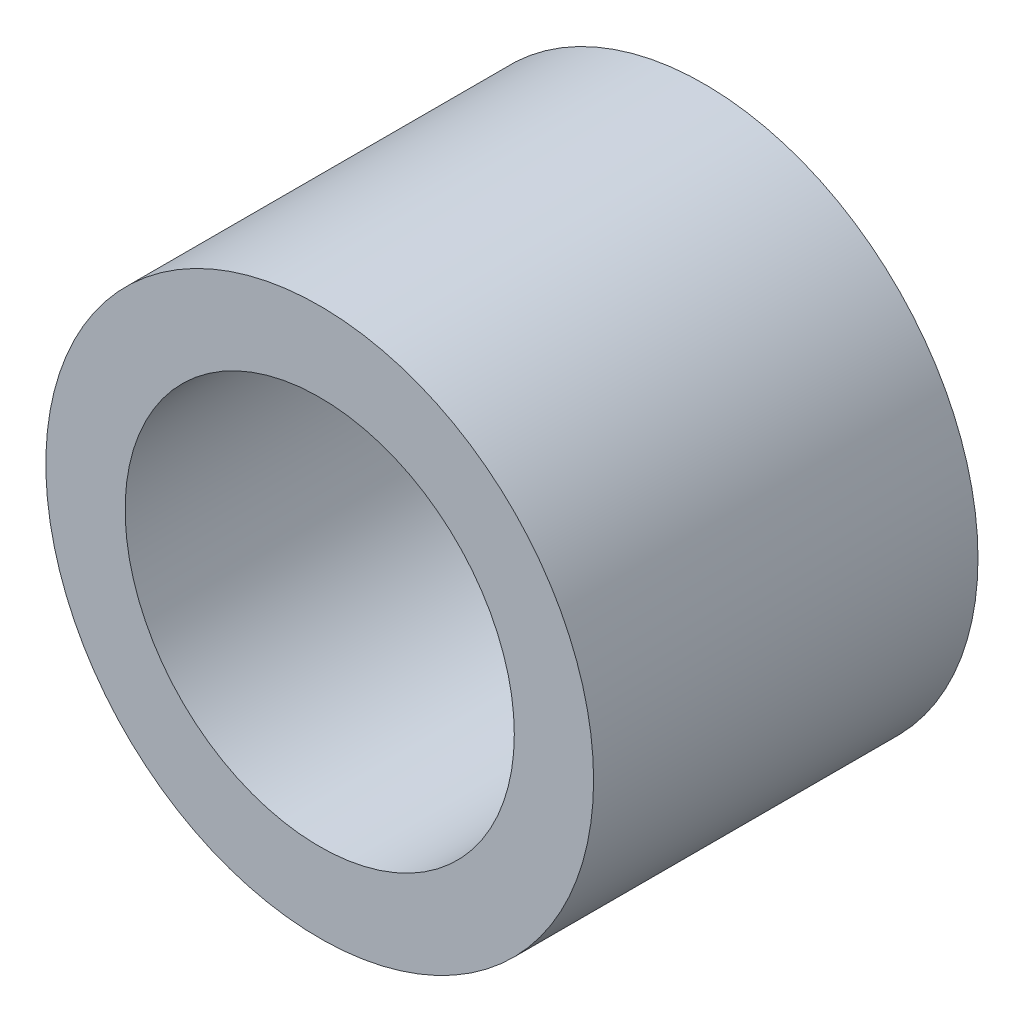
from build123d import *

# Parameters (mm, degrees)
S01_INSTALLED_BRASS_ENVELOPE_SIMPLIF_R       = 2.85
S01_INSTALLED_BRASS_ENVELOPE_SIMPLIF_R_2     = 2.025
F_01_INSTALLED_BRASS_ENVELOPE_SIMPLIFI_DEPTH = 4


with BuildPart() as part:
    # S01 - Installed brass envelope - simplified threads → 01 - Installed brass envelope - simplified threads (new body)
    with BuildSketch(Plane.XY):
        Circle(S01_INSTALLED_BRASS_ENVELOPE_SIMPLIF_R)
        Circle(S01_INSTALLED_BRASS_ENVELOPE_SIMPLIF_R_2, mode=Mode.SUBTRACT)
    extrude(amount=F_01_INSTALLED_BRASS_ENVELOPE_SIMPLIFI_DEPTH)


solid = part.part
